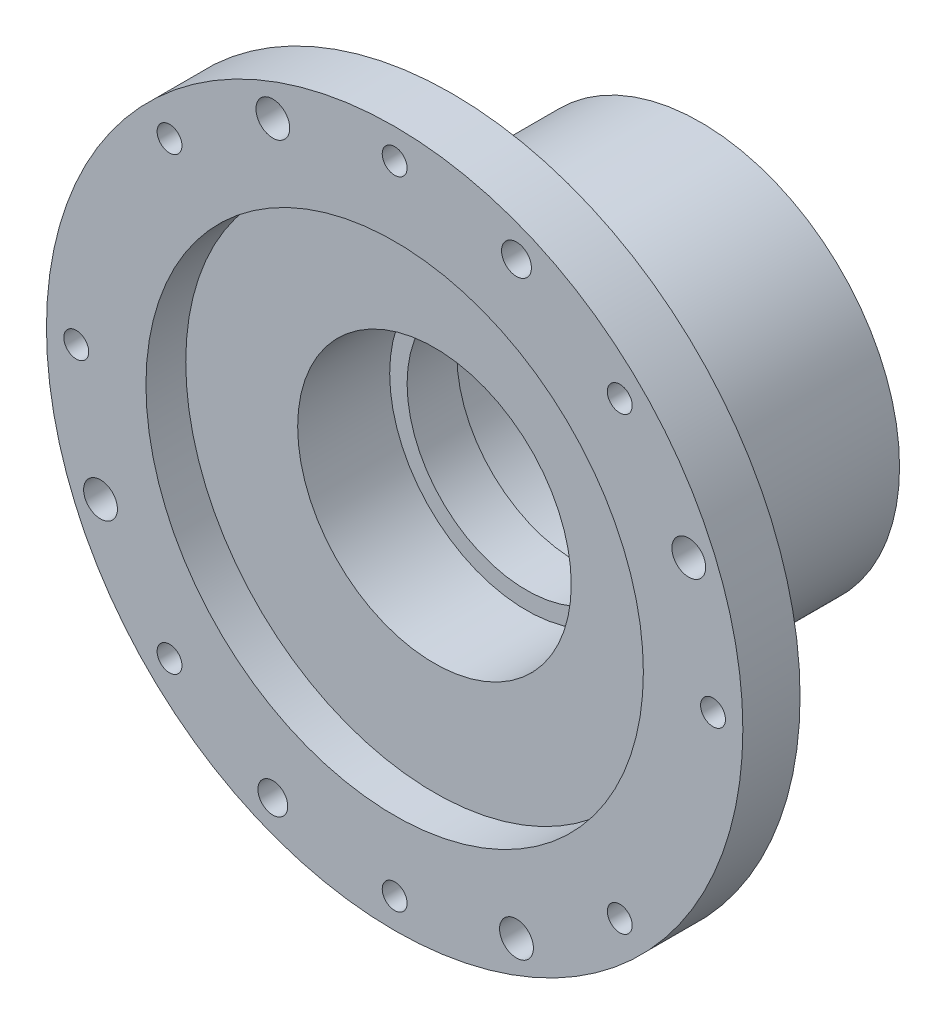
from build123d import *

# Parameters (mm, degrees)
SKETCH2_R                                    = 2.5
SKETCH2_R_2                                  = 3
SKETCH2_R_3                                  = 3.4
CUT_8XM6_TIE_2XDOWEL_4XM8_MOUNT_PCD128_DEPTH = 150
SKETCH3_R                                    = 1.65
CUT_4XM4_SEAL_COVER_TAPS_DEPTH               = 10


with BuildPart() as part:
    # Sketch1 → REV_Output_Housing_Body (revolve)
    with BuildSketch(Plane(origin=(0, 0, 0), x_dir=(1, 0, 0), z_dir=(0, 1, 0))):
        Polygon((27.5, 96), (40, 96), (40, 46), (70, 46), (70, 34.5), (50, 34.5), (50, 42.5), (27.5, 42.5), (27.5, 61), (24, 61), (24, 71), (27.5, 71), align=None)
    revolve(axis=Axis((0, 0, 150), (0, 0, -1)))

    # Sketch2 → CUT_8xM6_Tie_2xDowel_4xM8_Mount_PCD128 (cut, symmetric)
    with BuildSketch(Plane.XY):
        with Locations(Location((64, 0, 0), (0, 0, 180))):
            Circle(SKETCH2_R)
        with Locations(Location((45.2548, 45.2548, 0), (0, 0, 180))):
            Circle(SKETCH2_R)
        with Locations(Location((0, 64, 0), (0, 0, 180))):
            Circle(SKETCH2_R)
        with Locations(Location((-45.2548, 45.2548, 0), (0, 0, 180))):
            Circle(SKETCH2_R)
        with Locations(Location((-64, 0, 0), (0, 0, 180))):
            Circle(SKETCH2_R)
        with Locations(Location((-45.2548, -45.2548, 0), (0, 0, 180))):
            Circle(SKETCH2_R)
        with Locations(Location((0, -64, 0), (0, 0, 180))):
            Circle(SKETCH2_R)
        with Locations(Location((45.2548, -45.2548, 0), (0, 0, 180))):
            Circle(SKETCH2_R)
        with Locations(Location((24.4917, 59.1283, 0), (0, 0, 180))):
            Circle(SKETCH2_R_2)
        with Locations(Location((-24.4917, -59.1283, 0), (0, 0, 180))):
            Circle(SKETCH2_R_2)
        with Locations(Location((59.1283, 24.4917, 0), (0, 0, 180))):
            Circle(SKETCH2_R_3)
        with Locations(Location((-24.4917, 59.1283, 0), (0, 0, 180))):
            Circle(SKETCH2_R_3)
        with Locations(Location((-59.1283, -24.4917, 0), (0, 0, 180))):
            Circle(SKETCH2_R_3)
        with Locations(Location((24.4917, -59.1283, 0), (0, 0, 180))):
            Circle(SKETCH2_R_3)
    extrude(amount=CUT_8XM6_TIE_2XDOWEL_4XM8_MOUNT_PCD128_DEPTH, both=True, mode=Mode.SUBTRACT)

    # Sketch3 → CUT_4xM4_Seal_Cover_Taps (cut)
    with BuildSketch(Plane(origin=(0, 0, -96), x_dir=(-1, 0, 0), z_dir=(0, 0, -1))):
        with Locations((23.8649, 23.8649)):
            Circle(SKETCH3_R)
        with Locations((-23.8649, 23.8649)):
            Circle(SKETCH3_R)
        with Locations((-23.8649, -23.8649)):
            Circle(SKETCH3_R)
        with Locations((23.8649, -23.8649)):
            Circle(SKETCH3_R)
    extrude(amount=-CUT_4XM4_SEAL_COVER_TAPS_DEPTH, mode=Mode.SUBTRACT)


solid = part.part
